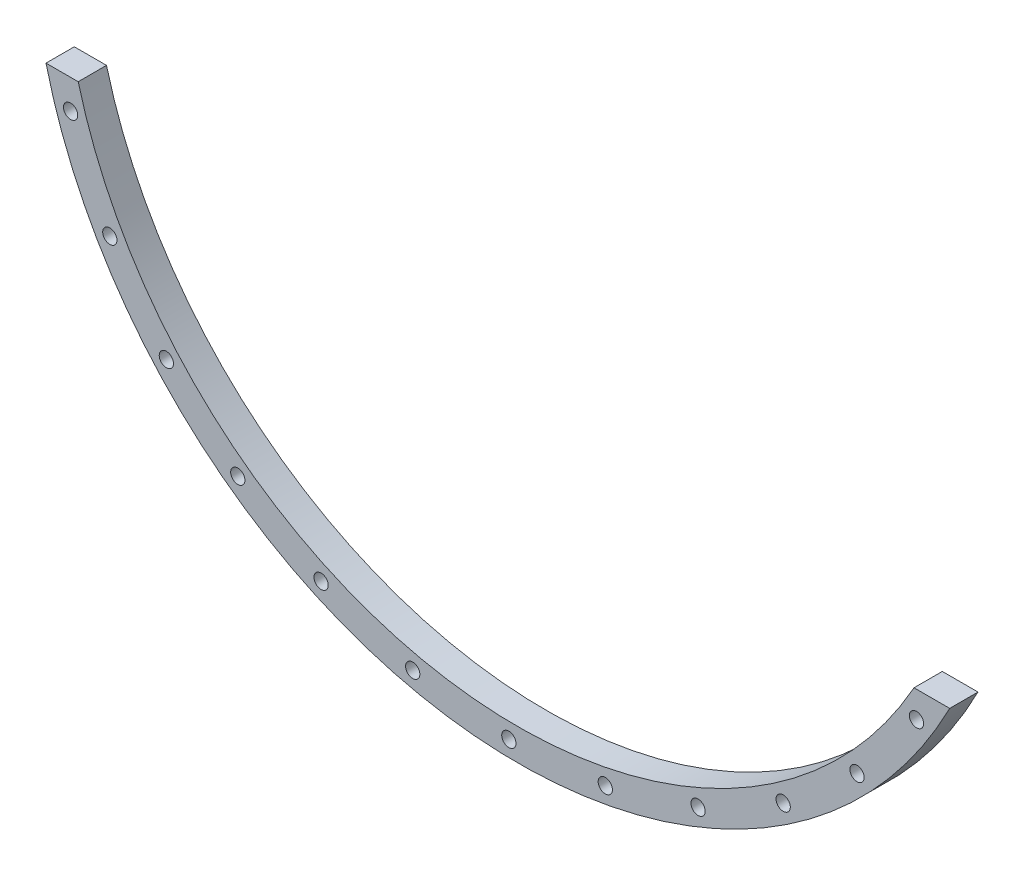
from build123d import *

# Parameters (mm, degrees)
BOSS_EXTRUDE1_DEPTH = 3.175
SKETCH4_R           = 1.6
CUT_EXTRUDE3_DEPTH  = 153.126359575


with BuildPart() as part:
    # Sketch1 → Boss-Extrude1 (new, symmetric)
    with BuildSketch(Plane.XY):
        with BuildLine():
            Line((88.904443084, -50), (96.911769633, -50))
            ThreePointArc((96.911769633, -50), (-12.794056242, -108.31825077), (-105.853672586, -26))
            Line((-105.853672586, -26), (-98.630624048, -26))
            ThreePointArc((-98.630624048, -26), (-12.947959261, -101.174850388), (88.904443084, -50))
        make_face()
    extrude(amount=BOSS_EXTRUDE1_DEPTH, both=True)

    # Sketch4 → Cut-Extrude3 (cut, through all)
    with BuildSketch(Plane.XY.offset(3.175)):
        with Locations((-103.194571877, -21.934683381)):
            Circle(SKETCH4_R)
        with Locations((-105.407458575, -4.417881468)):
            Circle(SKETCH4_R)
        with Locations((-104.668100989, -13.222656141)):
            Circle(SKETCH4_R)
        with Locations((-100.336462469, 32.601292907)):
            Circle(SKETCH4_R)
        with Locations((104.295371407, 15.897342642)):
            Circle(SKETCH4_R)
        with Locations((100.708995202, 31.43164465)):
            Circle(SKETCH4_R)
        with Locations((94.822771885, 46.248155986)):
            Circle(SKETCH4_R)
        with Locations((-103.194571877, 21.934683381)):
            Circle(SKETCH4_R)
        with Locations((-104.668100989, 13.222656141)):
            Circle(SKETCH4_R)
        with Locations((-105.407458575, 4.417881468)):
            Circle(SKETCH4_R)
        with Locations((89.469074145, -55.906482377)):
            Circle(SKETCH4_R)
        with Locations((-44.130594647, 95.826617472)):
            Circle(SKETCH4_R)
        with Locations((-62.82106423, 84.757087545)):
            Circle(SKETCH4_R)
        with Locations((-78.848228037, 70.094271773)):
            Circle(SKETCH4_R)
        with Locations((-91.532612735, 52.45980181)):
            Circle(SKETCH4_R)
        with Locations((94.822771885, -46.248155986)):
            Circle(SKETCH4_R)
        with Locations((100.708995202, -31.43164465)):
            Circle(SKETCH4_R)
        with Locations((104.295371407, -15.897342642)):
            Circle(SKETCH4_R)
        with Locations((105.5, 0)):
            Circle(SKETCH4_R)
        with Locations((76.122528254, -73.04526468)):
            Circle(SKETCH4_R)
        with Locations((89.469074145, 55.906482377)):
            Circle(SKETCH4_R)
        with Locations((76.122528254, 73.04526468)):
            Circle(SKETCH4_R)
        with Locations((59.54875959, 87.08728513)):
            Circle(SKETCH4_R)
        with Locations((40.450414858, 97.437230758)):
            Circle(SKETCH4_R)
        with Locations((19.637170436, 103.656314507)):
            Circle(SKETCH4_R)
        with Locations((-2.008593938, 105.480877653)):
            Circle(SKETCH4_R)
        with Locations((-23.569203757, 102.833567643)):
            Circle(SKETCH4_R)
        with Locations((-91.532612735, -52.45980181)):
            Circle(SKETCH4_R)
        with Locations((-62.82106423, -84.757087545)):
            Circle(SKETCH4_R)
        with Locations((-44.130594647, -95.826617472)):
            Circle(SKETCH4_R)
        with Locations((-23.569203757, -102.833567643)):
            Circle(SKETCH4_R)
        with Locations((-2.008593938, -105.480877653)):
            Circle(SKETCH4_R)
        with Locations((19.637170436, -103.656314507)):
            Circle(SKETCH4_R)
        with Locations((40.450414858, -97.437230758)):
            Circle(SKETCH4_R)
        with Locations((59.54875959, -87.08728513)):
            Circle(SKETCH4_R)
        with Locations((-78.848228037, -70.094271773)):
            Circle(SKETCH4_R)
        with Locations((-100.336462469, -32.601292907)):
            Circle(SKETCH4_R)
    extrude(amount=-CUT_EXTRUDE3_DEPTH, mode=Mode.SUBTRACT)


solid = part.part
